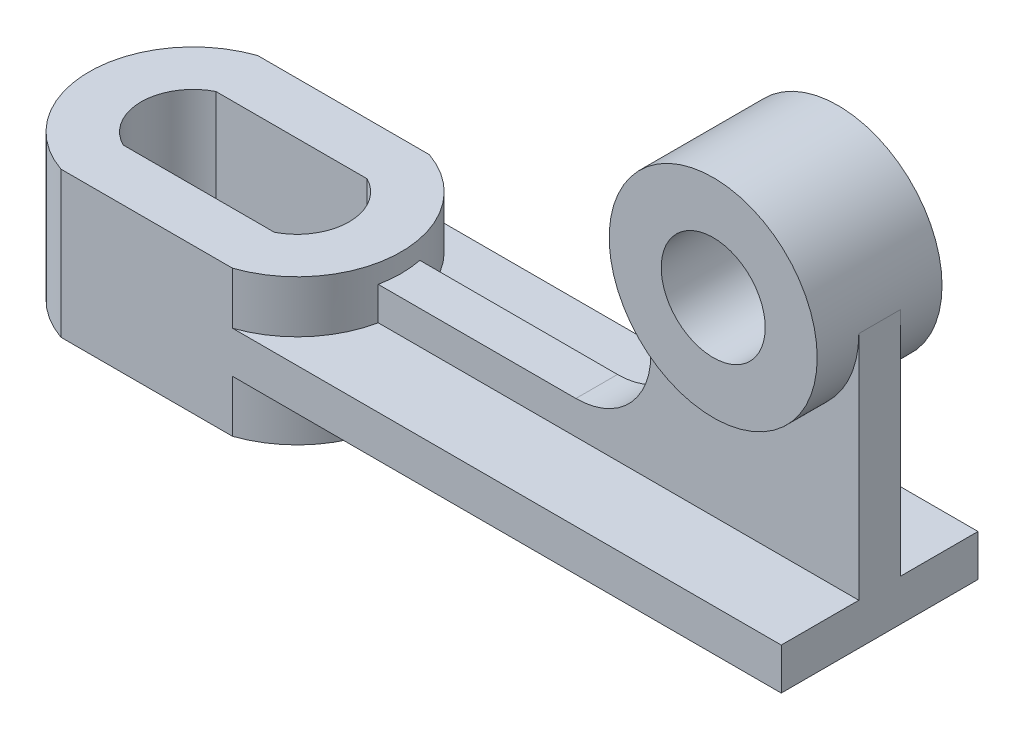
from build123d import *

# Parameters (mm, degrees)
BOSS_EXTRUDE1_DEPTH = 17.5
SKETCH3_W           = 47.284329966
SKETCH3_H           = 10
BOSS_EXTRUDE2_DEPTH = 152.5
CUT_EXTRUDE1_DEPTH  = 152.5
SKETCH5_R           = 25
SKETCH5_R_2         = 12.5
BOSS_EXTRUDE3_DEPTH = 15
BOSS_EXTRUDE4_DEPTH = 5
RIB1_REACH          = 178.424
SKETCH7_WALL_W      = 419.848137108
SKETCH7_WALL_H      = 10
FILLET1_R           = 18


with BuildPart() as part:
    # Sketch2 → Boss-Extrude1 (new, symmetric)
    with BuildSketch(Plane(origin=(0, 0, 0), x_dir=(1, 0, 0), z_dir=(0, 1, 0))):
        with BuildLine():
            Line((-20.626994213, -23.642164983), (20.626994213, -23.642164983))
            ThreePointArc((20.626994213, -23.642164983), (37.5, 0), (20.626994213, 23.642164983))
            Line((20.626994213, 23.642164983), (-20.626994213, 23.642164983))
            ThreePointArc((-20.626994213, 23.642164983), (-37.5, 0), (-20.626994213, -23.642164983))
        make_face()
        with BuildLine():
            Line((-18.165876764, -11.142164983), (18.165876764, -11.142164983))
            ThreePointArc((18.165876764, -11.142164983), (25, 0), (18.165876764, 11.142164983))
            Line((18.165876764, 11.142164983), (-18.165876764, 11.142164983))
            ThreePointArc((-18.165876764, 11.142164983), (-25, 0), (-18.165876764, -11.142164983))
        make_face(mode=Mode.SUBTRACT)
    extrude(amount=BOSS_EXTRUDE1_DEPTH, both=True)

    # Sketch3 → Boss-Extrude2 (add)
    with BuildSketch(Plane(origin=(0, 0, 0), x_dir=(0, 0, -1), z_dir=(1, 0, 0))):
        Rectangle(SKETCH3_W, SKETCH3_H)
    extrude(amount=BOSS_EXTRUDE2_DEPTH)

    # Sketch4 → Cut-Extrude1 (cut)
    with BuildSketch(Plane(origin=(0, 17.5, 0), x_dir=(1, 0, 0), z_dir=(0, 1, 0))):
        with BuildLine():
            Line((-18.165876764, -11.142164983), (18.165876764, -11.142164983))
            ThreePointArc((18.165876764, -11.142164983), (25, 0), (18.165876764, 11.142164983))
            Line((18.165876764, 11.142164983), (-18.165876764, 11.142164983))
            ThreePointArc((-18.165876764, 11.142164983), (-25, 0), (-18.165876764, -11.142164983))
        make_face()
    extrude(amount=-CUT_EXTRUDE1_DEPTH, mode=Mode.SUBTRACT)



with BuildPart() as body_2:
    # Sketch5 → Boss-Extrude3 (new, symmetric)
    with BuildSketch(Plane.XY):
        with Locations((127.5, 60.5)):
            Circle(SKETCH5_R)
        with Locations((127.5, 60.5)):
            Circle(SKETCH5_R_2, mode=Mode.SUBTRACT)
    extrude(amount=BOSS_EXTRUDE3_DEPTH, both=True)


with BuildPart() as part_1:
    add(part.part)

    add(body_2.part)  # Boss-Extrude4 merges body 2
    # Sketch6 → Boss-Extrude4 (add, symmetric)
    with BuildSketch(Plane.XY):
        with BuildLine():
            Line((102.5, 60.5), (102.5, 0))
            Line((102.5, 0), (152.5, 0))
            Line((152.5, 0), (152.5, 60.5))
            ThreePointArc((152.5, 60.5), (127.5, 35.5), (102.5, 60.5))
        make_face()
    extrude(amount=BOSS_EXTRUDE4_DEPTH, both=True)

    # Sketch7 wall → Rib1 (add, up to next)
    with BuildSketch(Plane(origin=(70, 13, 0), x_dir=(1, 0, 0), z_dir=(0, 1, 0)), mode=Mode.PRIVATE) as rib1_sk1:
        Rectangle(SKETCH7_WALL_W, SKETCH7_WALL_H)
    rib1_tool1 = extrude(rib1_sk1.sketch, amount=-RIB1_REACH, mode=Mode.PRIVATE) - part_1.part
    add(rib1_tool1.solids().sort_by_distance((70, 13, 0))[0])

    # Fillet1
    fillet1_edges = [part_1.edges().sort_by_distance(p)[0] for p in [
        (102.5, 13, 0),
    ]]
    fillet(fillet1_edges, radius=FILLET1_R)


solid = part_1.part
